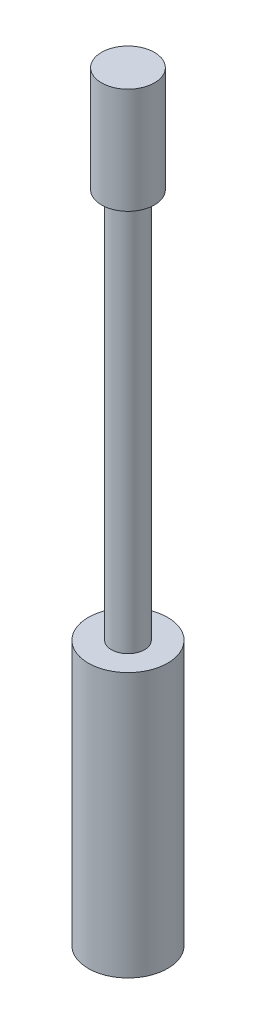
from build123d import *

# Parameters (mm, degrees)
SKETCH1_R           = 6
BOSS_EXTRUDE1_DEPTH = 40
SKETCH2_R           = 2.5
BOSS_EXTRUDE2_DEPTH = 59
SKETCH3_R           = 4
BOSS_EXTRUDE3_DEPTH = 16


with BuildPart() as part:
    # Sketch1 → Boss-Extrude1 (new body)
    with BuildSketch(Plane(origin=(0, 0, 0), x_dir=(1, 0, 0), z_dir=(0, 1, 0))):
        with Locations(Location((0, 0, 0), (0, 0, 270))):
            Circle(SKETCH1_R)
    extrude(amount=BOSS_EXTRUDE1_DEPTH)

    # Sketch2 → Boss-Extrude2 (add)
    with BuildSketch(Plane(origin=(0, 40, 0), x_dir=(1, 0, 0), z_dir=(0, 1, 0))):
        with Locations(Location((0, 0, 0), (0, 0, 270))):
            Circle(SKETCH2_R)
    extrude(amount=BOSS_EXTRUDE2_DEPTH)

    # Sketch3 → Boss-Extrude3 (add)
    with BuildSketch(Plane(origin=(0, 99, 0), x_dir=(1, 0, 0), z_dir=(0, 1, 0))):
        with Locations(Location((0, 0, 0), (0, 0, 270))):
            Circle(SKETCH3_R)
    extrude(amount=BOSS_EXTRUDE3_DEPTH)


solid = part.part
